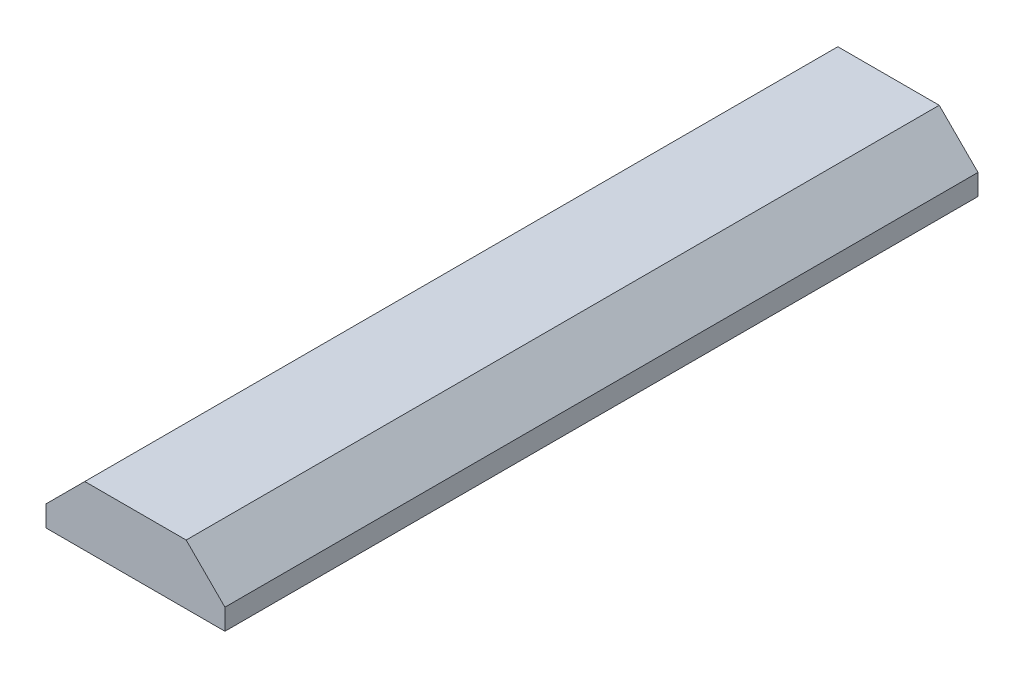
from build123d import *

# Parameters (mm, degrees)
AUFSATZ_LINEAR_AUSTRAGEN1_DEPTH = 50.5


with BuildPart() as part:
    # Skizze1 → Aufsatz-Linear austragen1 (new body)
    with BuildSketch(Plane.XY):
        Polygon((3.4, 1.808858787), (-3.4, 1.808858787), (-6, -0.791141213), (-6, -2.191141213), (6, -2.191141213), (6, -0.791141213), align=None)
    extrude(amount=AUFSATZ_LINEAR_AUSTRAGEN1_DEPTH)


solid = part.part
